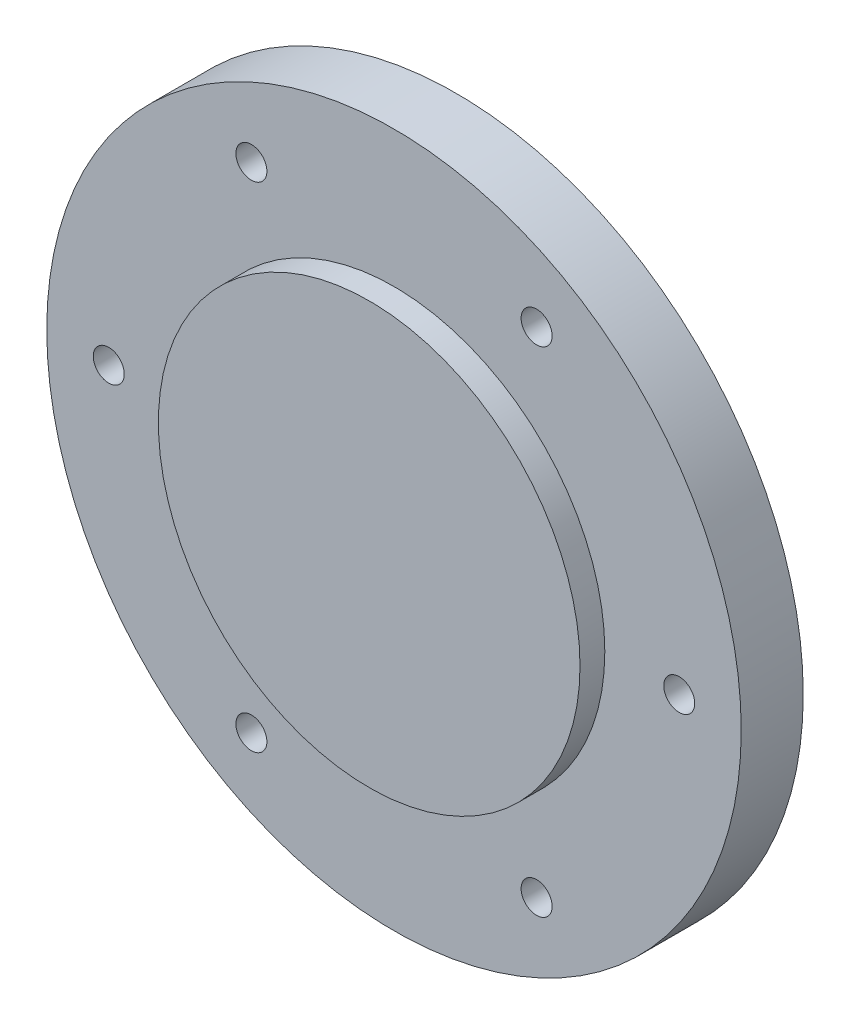
from build123d import *

# Parameters (mm, degrees)
SK_DISC_R                 = 28
OUTPUT_DISC_DEPTH         = 5
SK_PILOT_R                = 17
PILOT_BOSS_DEPTH          = 2
SK_OUTHOLE_R              = 1.25
OUTPUT_TAPPED_HOLE_DEPTH  = 5
OUTPUT_HOLE_PATTERN_COUNT = 6


with BuildPart() as part:
    # SK_Disc → Output_Disc (new body)
    with BuildSketch(Plane.XY):
        Circle(SK_DISC_R)
    extrude(amount=OUTPUT_DISC_DEPTH)

    # SK_Pilot → Pilot_Boss (add)
    with BuildSketch(Plane.XY.offset(5)):
        Circle(SK_PILOT_R)
    extrude(amount=PILOT_BOSS_DEPTH)

    # SK_OutHole → Output_Tapped_Hole (cut)
    with BuildSketch(Plane.XY.offset(5)):
        with Locations((23, 0)):
            Circle(SK_OUTHOLE_R)
    output_tapped_hole = extrude(amount=-OUTPUT_TAPPED_HOLE_DEPTH, mode=Mode.SUBTRACT)

    # Output_Hole_Pattern: Output_Tapped_Hole ×6 about axis
    output_hole_pattern_axis = Axis((0, 0, -0.35), (0, 0, 1))
    for i in range(1, OUTPUT_HOLE_PATTERN_COUNT):
        add(output_tapped_hole.rotate(output_hole_pattern_axis, i * 360 / OUTPUT_HOLE_PATTERN_COUNT), mode=Mode.SUBTRACT)


solid = part.part
